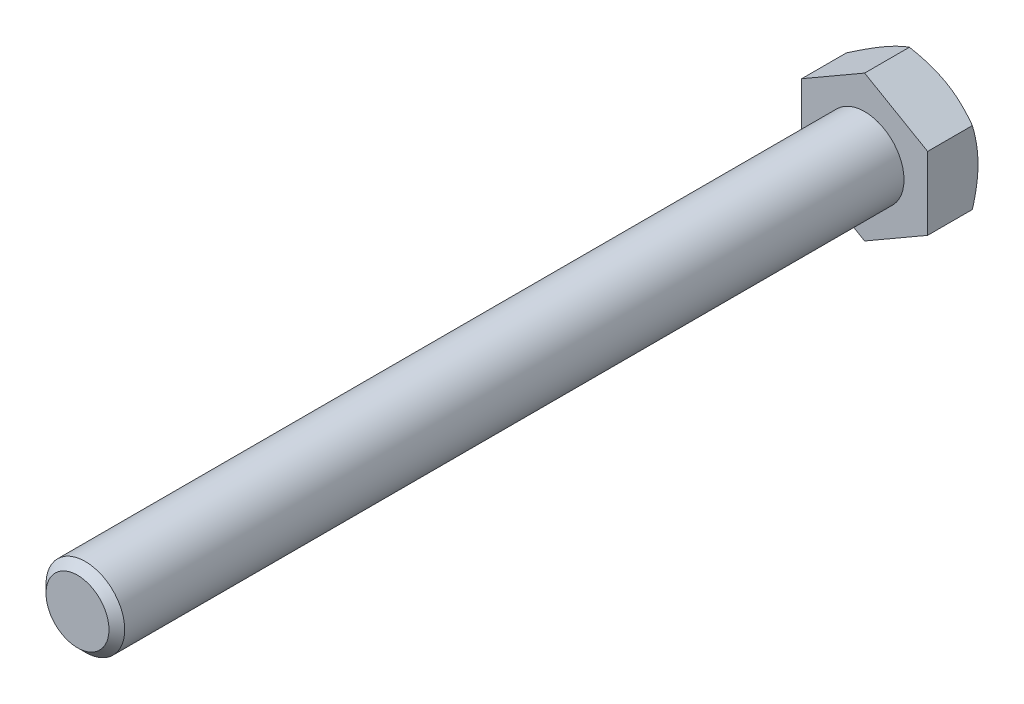
from build123d import *

# Parameters (mm, degrees)
ESQUISSE1_W        = 5
ESQUISSE1_H        = 100
CHANFREIN1_SIZE    = 1
BOSS_EXTRU_1_DEPTH = 6.4


with BuildPart() as part:
    # Esquisse1 → Base-Révolution (revolve)
    with BuildSketch(Plane(origin=(0, 0, 0), x_dir=(1, 0, 0), z_dir=(0, 1, 0))):
        with Locations((2.5, -50)):
            Rectangle(ESQUISSE1_W, ESQUISSE1_H)
    revolve(axis=Axis((0, 0, 0), (0, 0, 1)))

    # Chanfrein1
    chanfrein1_edges = [part.edges().sort_by_distance(p)[0] for p in [
        (-5, 0, 100),
    ]]
    chamfer(chanfrein1_edges, length=CHANFREIN1_SIZE)

    # Esquisse6 → Boss.-Extru.1 (add)
    with BuildSketch(Plane.XY):
        Polygon((8, -4.618802154), (8, 4.618802154), (0, 9.237604307), (-8, 4.618802154), (-8, -4.618802154), (0, -9.237604307), align=None)
    extrude(amount=-BOSS_EXTRU_1_DEPTH)

    # Esquisse7 → Enlèvement de matière-Révolution1 (revolve, cut)
    with BuildSketch(Plane(origin=(0, 0, 0), x_dir=(1, 0, 0), z_dir=(0, 1, 0))):
        Polygon((-8, 6.4), (-19.085125168, 6.4), (-19.085125168, 0), align=None)
    revolve(axis=Axis((0, 0, -6.239446496), (0, 0, 1)), mode=Mode.SUBTRACT)


solid = part.part
